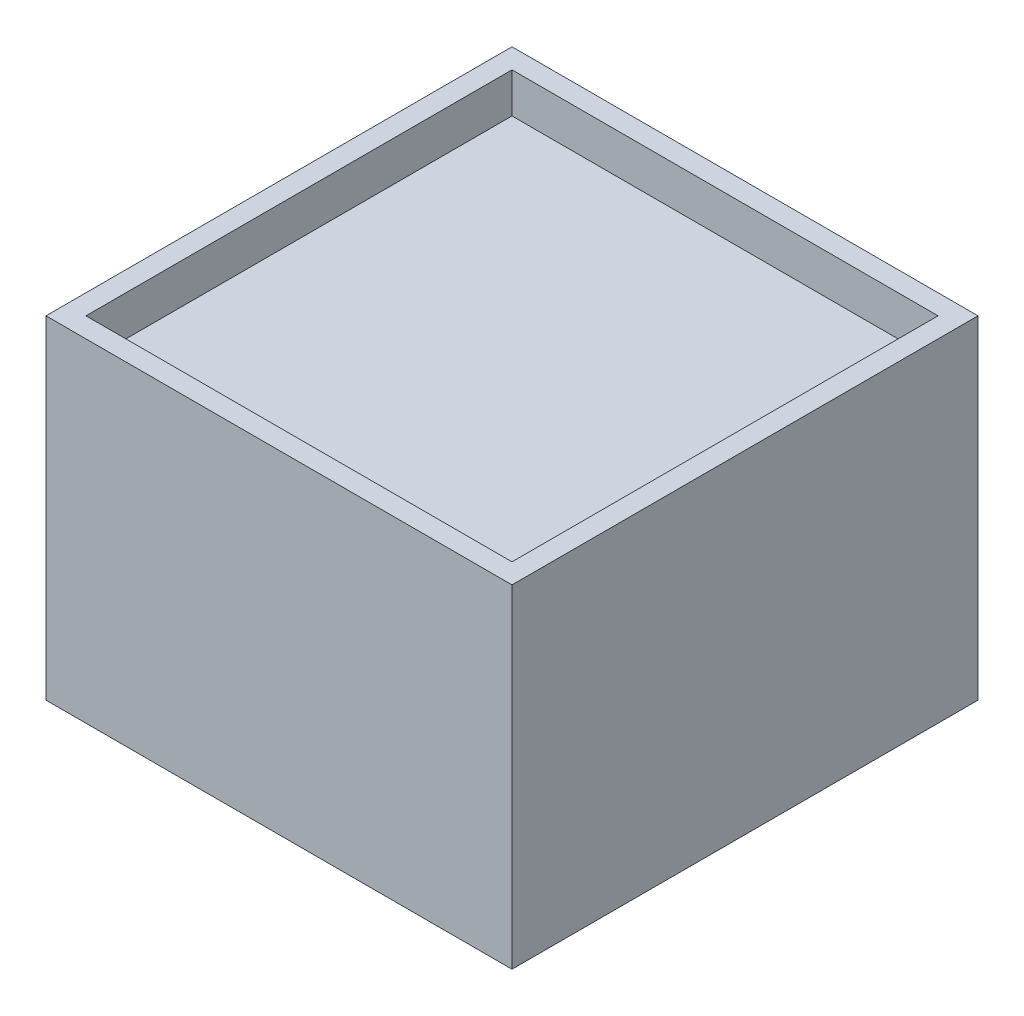
from build123d import *

# Parameters (mm, degrees)
SKETCH_1_W          = 35
SKETCH_1_H          = 35
EXTRUDE_1_DEPTH     = 25
SKETCH_2_W          = 32
SKETCH_2_H          = 32
CUT_EXTRUDE_1_DEPTH = 3


with BuildPart() as part:
    # 草图1 → 凸台-拉伸1 (new body)
    with BuildSketch(Plane(origin=(0, 0, 0), x_dir=(1, 0, 0), z_dir=(0, 1, 0))):
        Rectangle(SKETCH_1_W, SKETCH_1_H)
    extrude(amount=EXTRUDE_1_DEPTH)

    # 草图2 → 切除-拉伸1 (cut)
    with BuildSketch(Plane(origin=(0, 25, 0), x_dir=(1, 0, 0), z_dir=(0, 1, 0))):
        Rectangle(SKETCH_2_W, SKETCH_2_H)
    extrude(amount=-CUT_EXTRUDE_1_DEPTH, mode=Mode.SUBTRACT)


solid = part.part
